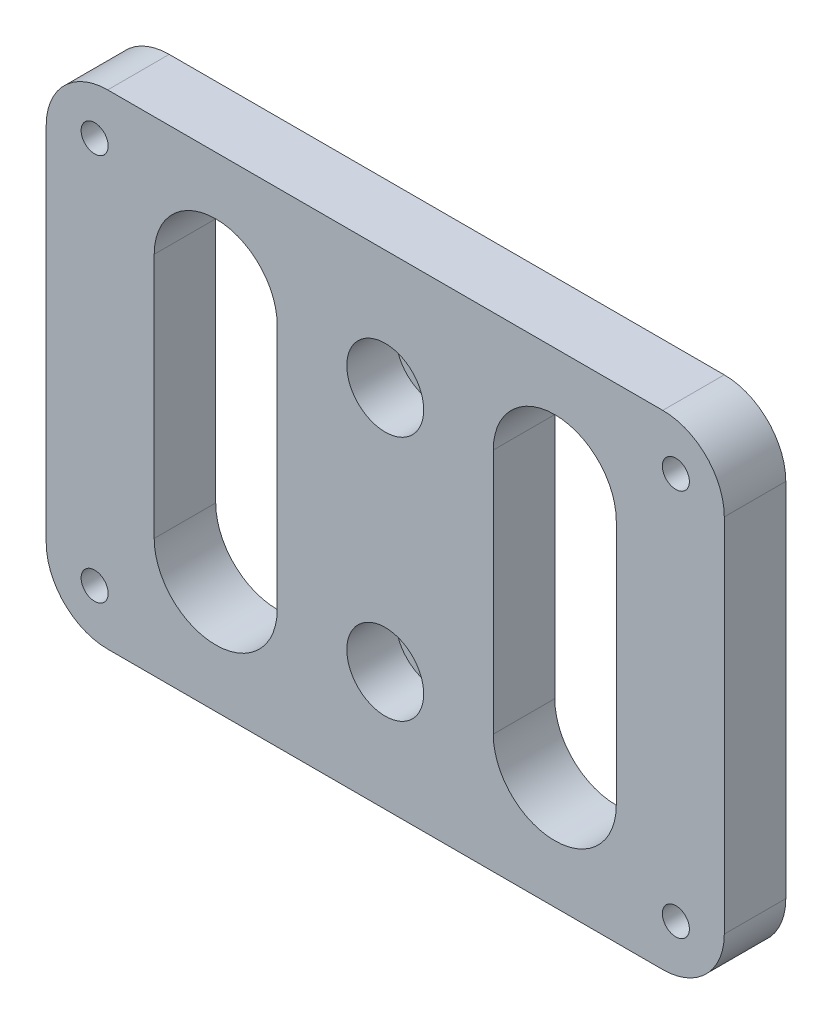
from build123d import *

# Parameters (mm, degrees)
SKETCH1_W           = 70
SKETCH1_H           = 50
SKETCH1_R           = 1.397
SKETCH1_R_2         = 2.4892
BOSS_EXTRUDE1_DEPTH = 6.35
FILLET1_R           = 6.35
SKETCH3_R           = 3.96875
CUT_EXTRUDE1_DEPTH  = 5.08


with BuildPart() as part:
    # Sketch1 → Boss-Extrude1 (new body)
    with BuildSketch(Plane.XY):
        Rectangle(SKETCH1_W, SKETCH1_H)
        with Locations((30, 20)):
            Circle(SKETCH1_R, mode=Mode.SUBTRACT)
        with Locations((30, -20)):
            Circle(SKETCH1_R, mode=Mode.SUBTRACT)
        with Locations((-30, -20)):
            Circle(SKETCH1_R, mode=Mode.SUBTRACT)
        with Locations((-30, 20)):
            Circle(SKETCH1_R, mode=Mode.SUBTRACT)
        with Locations((0, 12.7)):
            Circle(SKETCH1_R_2, mode=Mode.SUBTRACT)
        with Locations((0, -12.7)):
            Circle(SKETCH1_R_2, mode=Mode.SUBTRACT)
        with BuildLine():
            Line((-23.85, -12.7), (-23.85, 12.7))
            ThreePointArc((-23.85, 12.7), (-17.5, 19.05), (-11.15, 12.7))
            Line((-11.15, 12.7), (-11.15, -12.7))
            ThreePointArc((-11.15, -12.7), (-17.5, -19.05), (-23.85, -12.7))
        make_face(mode=Mode.SUBTRACT)
        with BuildLine():
            Line((23.85, 12.7), (23.85, -12.7))
            ThreePointArc((23.85, -12.7), (17.5, -19.05), (11.15, -12.7))
            Line((11.15, -12.7), (11.15, 12.7))
            ThreePointArc((11.15, 12.7), (17.5, 19.05), (23.85, 12.7))
        make_face(mode=Mode.SUBTRACT)
    extrude(amount=BOSS_EXTRUDE1_DEPTH)

    # Fillet1
    fillet1_edges = [part.edges().sort_by_distance(p)[0] for p in [
        (-35, 25, 3.175),
        (35, 25, 3.175),
        (35, -25, 3.175),
        (-35, -25, 3.175),
    ]]
    fillet(fillet1_edges, radius=FILLET1_R)

    # Sketch3 → Cut-Extrude1 (cut)
    with BuildSketch(Plane.XY.offset(6.35)):
        with Locations((0, 12.7)):
            Circle(SKETCH3_R)
        with Locations((0, -12.7)):
            Circle(SKETCH3_R)
    extrude(amount=-CUT_EXTRUDE1_DEPTH, mode=Mode.SUBTRACT)


solid = part.part
